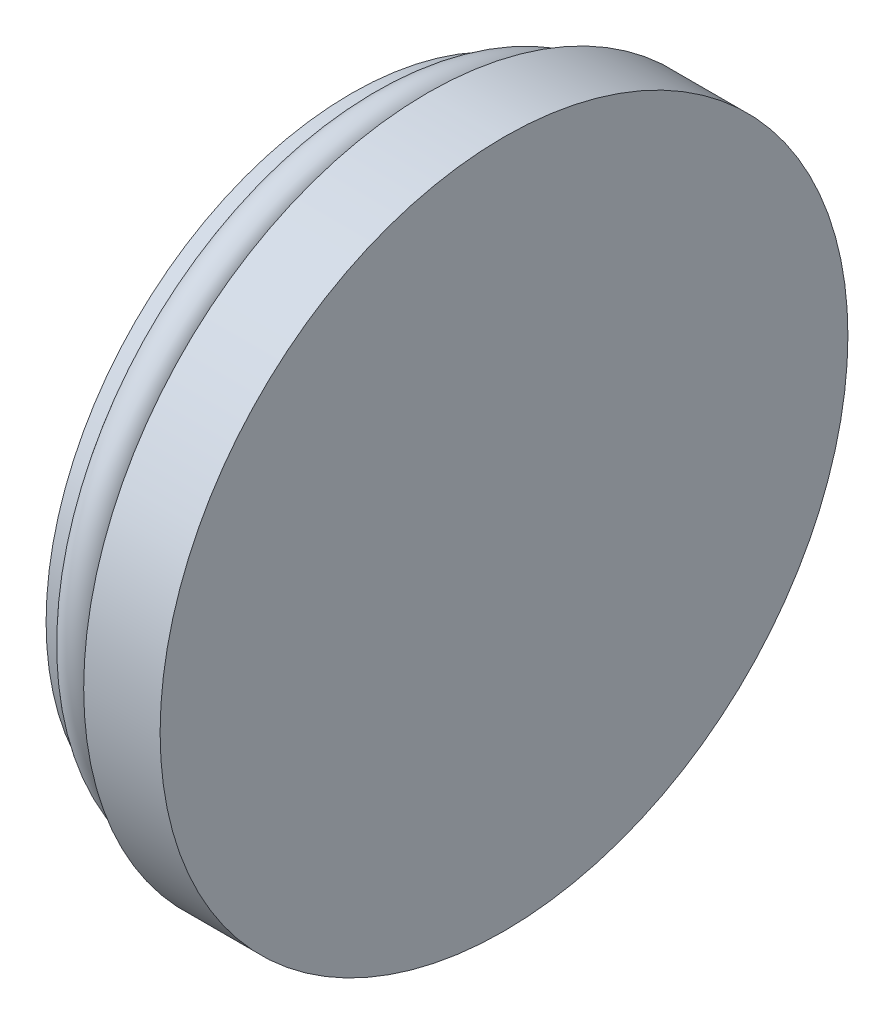
from build123d import *

# Parameters (mm, degrees)
SKETCH1_R           = 12.6746
BOSS_EXTRUDE1_DEPTH = 3.175
SKETCH2_R           = 14.2875
BOSS_EXTRUDE2_DEPTH = 3.175


with BuildPart() as part:
    # Sketch1 → Boss-Extrude1 (new body)
    with BuildSketch(Plane(origin=(0, 0, 0), x_dir=(0, 0, -1), z_dir=(1, 0, 0))):
        Circle(SKETCH1_R)
    extrude(amount=BOSS_EXTRUDE1_DEPTH)

    # Sketch2 → Boss-Extrude2 (add)
    with BuildSketch(Plane(origin=(3.175, 0, 0), x_dir=(0, 0, -1), z_dir=(1, 0, 0))):
        Circle(SKETCH2_R)
    extrude(amount=BOSS_EXTRUDE2_DEPTH)

    # Sketch3 → Revolve1 (revolve)
    with BuildSketch(Plane.XY, mode=Mode.PRIVATE) as revolve1_sk:
        with BuildLine():
            Line((2.38125, 12.7), (2.38125, 11.90625))
            Line((2.38125, 11.90625), (0.79375, 11.90625))
            Line((0.79375, 11.90625), (0.79375, 12.7))
            ThreePointArc((0.79375, 12.7), (1.5875, 13.49375), (2.38125, 12.7))
        make_face()
    revolve(revolve1_sk.sketch.rotate(Axis((0, 0, 0), (-1, 0, 0)), 90), axis=Axis((0, 0, 0), (-1, 0, 0)))


solid = part.part
